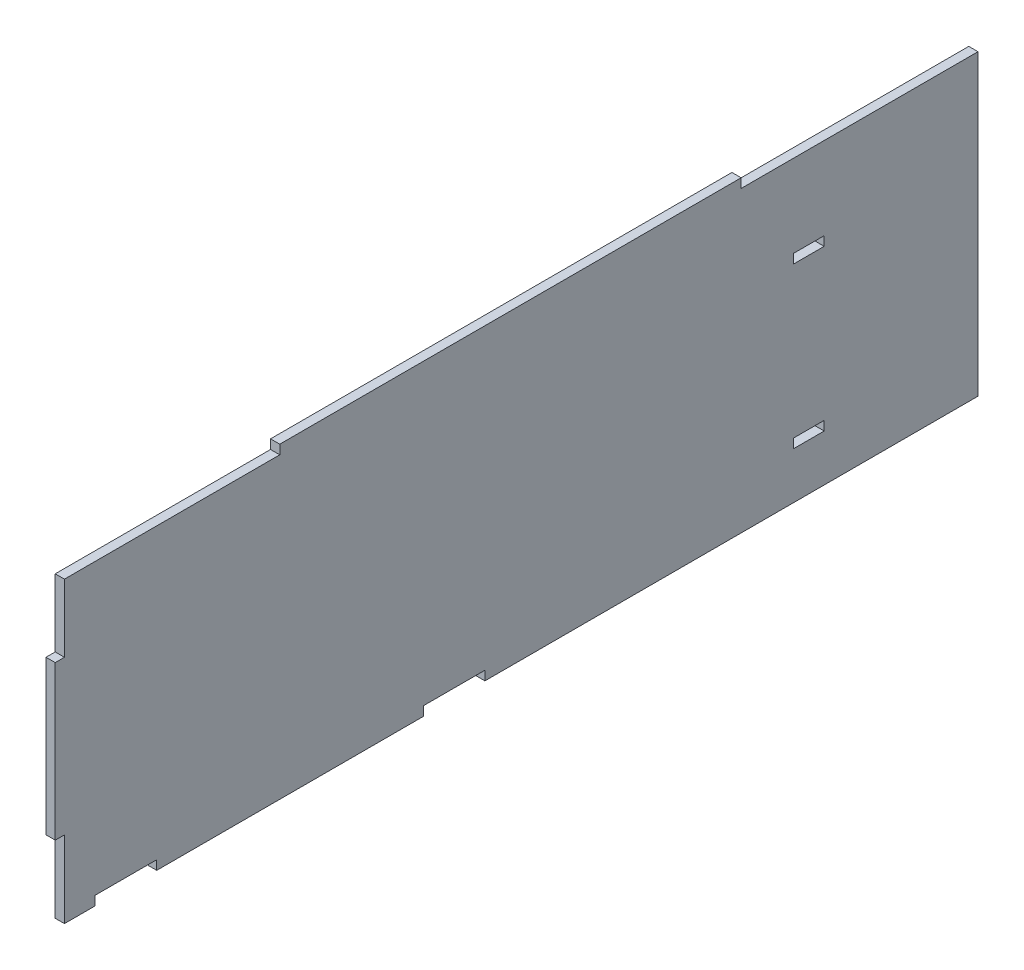
from build123d import *

# Parameters (mm, degrees)
ESQUISSE1_W        = 10
ESQUISSE1_H        = 3
BOSS_EXTRU_1_DEPTH = 3


with BuildPart() as part:
    # Esquisse1 → Boss.-Extru.1 (new body)
    with BuildSketch(Plane(origin=(3, 0, 0), x_dir=(0, 0, -1), z_dir=(1, 0, 0))):
        Polygon((-123.701897001, -54.63651717), (-113.701897001, -54.63651717), (-113.701897001, -51.63651717), (-93.701897001, -51.63651717), (-93.701897001, -54.63651717), (-7.001897001, -54.63651717), (-7.001897001, -51.63651717), (12.998102999, -51.63651717), (12.998102999, -54.63651717), (173.298102999, -54.63651717), (173.298102999, 42.36348283), (96.298102999, 42.36348283), (96.298102999, 45.36348283), (-53.701897001, 45.36348283), (-53.701897001, 42.36348283), (-123.701897001, 42.36348283), (-123.701897001, 20.36348283), (-126.701897001, 20.36348283), (-126.701897001, -29.63651717), (-123.701897001, -29.63651717), align=None)
        with Locations((118.298102999, -37.93651717)):
            Rectangle(ESQUISSE1_W, ESQUISSE1_H, mode=Mode.SUBTRACT)
        with Locations((118.298102999, 14.06348283)):
            Rectangle(ESQUISSE1_W, ESQUISSE1_H, mode=Mode.SUBTRACT)
    extrude(amount=-BOSS_EXTRU_1_DEPTH)


solid = part.part
